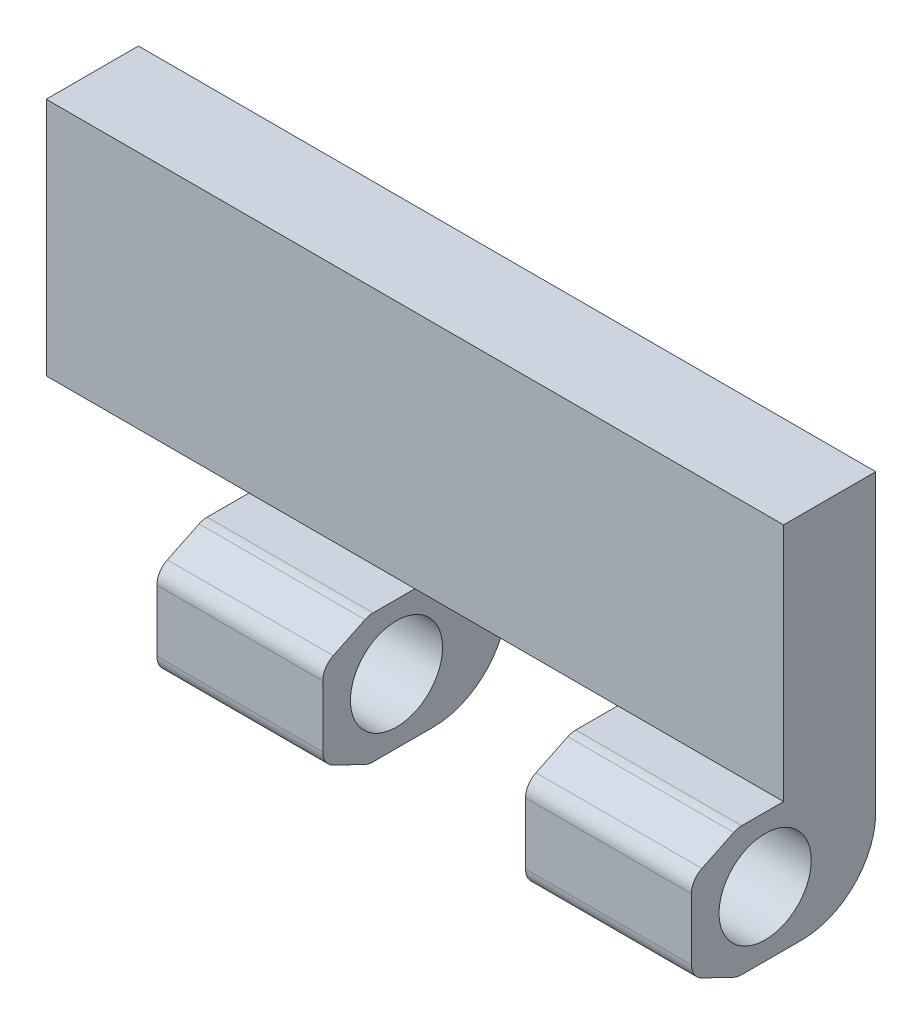
from build123d import *

# Parameters (mm, degrees)
SKETCH1_W           = 13
SKETCH1_H           = 40
BOSS_EXTRUDE1_DEPTH = 5
SKETCH2_R           = 2.5
BOSS_EXTRUDE2_DEPTH = 9
LPATTERN1_COUNT     = 2
LPATTERN1_PITCH     = 20


with BuildPart() as part:
    # Sketch1 → Boss-Extrude1 (new body)
    with BuildSketch(Plane(origin=(0, 0, 0), x_dir=(0, 1, 0), z_dir=(0, 0, 1))):
        Rectangle(SKETCH1_W, SKETCH1_H)
    extrude(amount=BOSS_EXTRUDE1_DEPTH)


with BuildPart() as body_2:
    # Sketch2 → Boss-Extrude2 (new body)
    with BuildSketch(Plane.YZ.offset(20)):
        with BuildLine():
            Line((-6.5, 0), (-9.5, 0))
            ThreePointArc((-9.5, 0), (-12.328427125, 1.171572875), (-13.5, 4))
            Line((-13.5, 4), (-13.5, 7.272429229))
            ThreePointArc((-13.5, 7.272429229), (-13.475070012, 7.494326663), (-13.401523057, 7.705160297))
            Line((-13.401523057, 7.705160297), (-12.572289088, 9.432731068))
            ThreePointArc((-12.572289088, 9.432731068), (-12.203339467, 9.846383798), (-11.67076603, 10))
            Line((-11.67076603, 10), (-8.32923397, 10))
            ThreePointArc((-8.32923397, 10), (-7.796660533, 9.846383798), (-7.427710912, 9.432731068))
            Line((-7.427710912, 9.432731068), (-6.598476943, 7.705160297))
            ThreePointArc((-6.598476943, 7.705160297), (-6.524929988, 7.494326663), (-6.5, 7.272429229))
            Line((-6.5, 7.272429229), (-6.5, 5))
            Line((-6.5, 5), (-6.5, 0))
        make_face()
        with Locations((-10, 6)):
            Circle(SKETCH2_R, mode=Mode.SUBTRACT)
    boss_extrude2 = extrude(amount=-BOSS_EXTRUDE2_DEPTH)


with BuildPart() as lpattern1_1:
    # LPattern1: Boss-Extrude2 ×2
    with Locations(*[(-i * LPATTERN1_PITCH, 0, 0) for i in range(1, LPATTERN1_COUNT)]):
        add(boss_extrude2)


with BuildPart() as body_2_1:
    add(body_2.part)

    # Combine1: union LPattern1_1, part
    add(lpattern1_1.part)
    add(part.part)


solid = body_2_1.part
